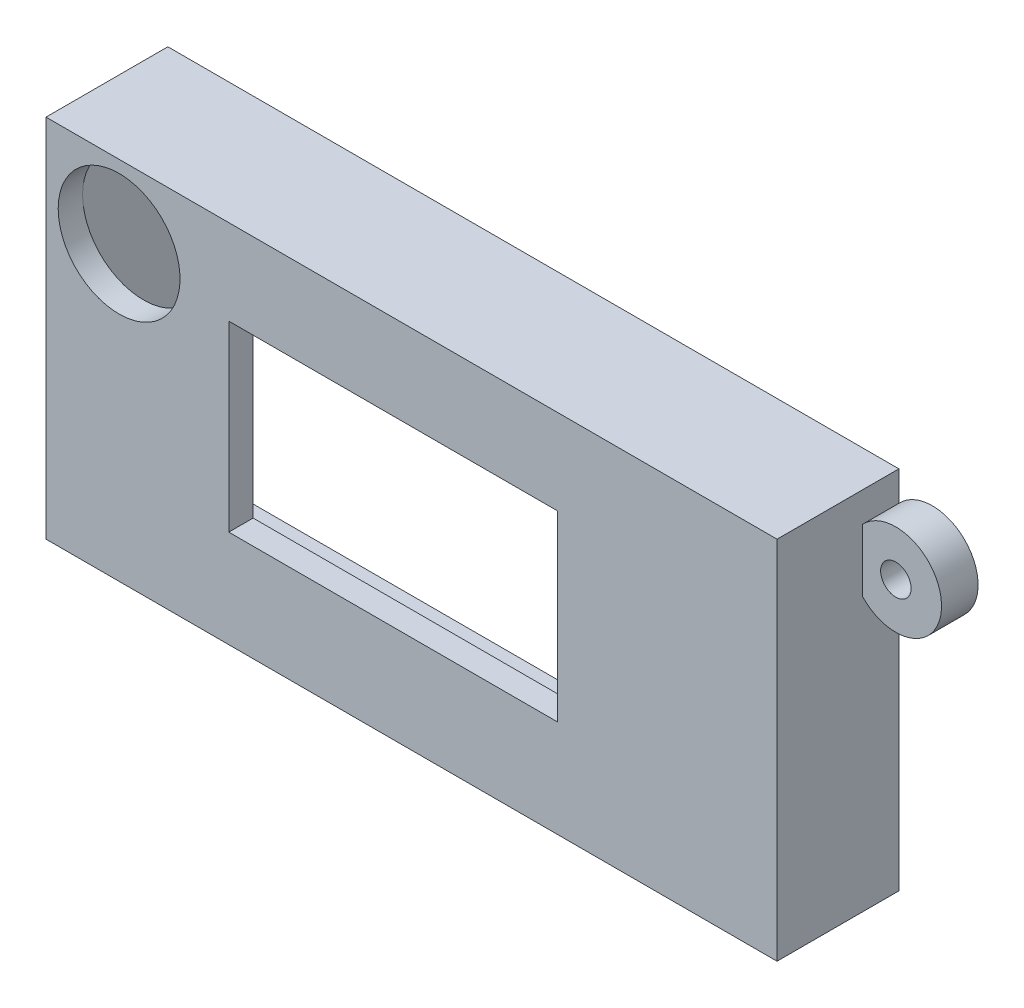
from build123d import *

# Parameters (mm, degrees)
SKIZZE1_W                       = 60
SKIZZE1_H                       = 30
AUFSATZ_LINEAR_AUSTRAGEN1_DEPTH = 10
SKIZZE2_R                       = 5
SKIZZE2_W                       = 27
SKIZZE2_H                       = 15
SCHNITT_LINEAR_AUSTRAGEN2_DEPTH = 36
SKIZZE3_R                       = 1.25
SKIZZE3_W                       = 58
SKIZZE3_H                       = 28
SCHNITT_LINEAR_AUSTRAGEN3_DEPTH = 8
SKIZZE3_4_R                     = 1.25
SKIZZE3_4_W                     = 58
SKIZZE3_4_H                     = 28
AUFSATZ_LINEAR_AUSTRAGEN3_DEPTH = 3
SKIZZE3_5_R                     = 1.25
SKIZZE3_5_W                     = 58
SKIZZE3_5_H                     = 28
SCHNITT_LINEAR_AUSTRAGEN7_DEPTH = 3
SKIZZE3_7_R                     = 1.25
AUFSATZ_LINEAR_AUSTRAGEN4_DEPTH = 3
AUFSATZ_LINEAR_AUSTRAGEN5_DEPTH = 3
SKIZZE3_11_R                    = 1.25
SCHNITT_LINEAR_AUSTRAGEN9_DEPTH = 41.874769712


with BuildPart() as part:
    # Skizze1 → Aufsatz-Linear austragen1 (new body)
    with BuildSketch(Plane.XY):
        Rectangle(SKIZZE1_W, SKIZZE1_H)
    extrude(amount=AUFSATZ_LINEAR_AUSTRAGEN1_DEPTH)

    # Skizze2 → Schnitt-Linear austragen2 (cut, through all)
    with BuildSketch(Plane(origin=(0, 0, 0), x_dir=(-1, 0, 0), z_dir=(0, 0, -1))):
        with Locations((24, 9)):
            Circle(SKIZZE2_R)
        with Locations((1.5, 0.5)):
            Rectangle(SKIZZE2_W, SKIZZE2_H)
    extrude(amount=-SCHNITT_LINEAR_AUSTRAGEN2_DEPTH, mode=Mode.SUBTRACT)

    # Skizze3 → Schnitt-Linear austragen3 (cut)
    # profile 1 of 3: a face of its own
    with BuildSketch(Plane(origin=(0, 0, 0), x_dir=(-1, 0, 0), z_dir=(0, 0, -1))):
        with BuildLine():
            Line((-30, 12.549509757), (-30, 7.450490243))
            ThreePointArc((-30, 7.450490243), (-36.5, 10), (-30, 12.549509757))
        make_face()
        with Locations((-32.75, 10)):
            Circle(SKIZZE3_R, mode=Mode.SUBTRACT)
    # profile 2 of 3: a face of its own
    with BuildSketch(Plane(origin=(0, 0, 0), x_dir=(-1, 0, 0), z_dir=(0, 0, -1))):
        Rectangle(SKIZZE3_W, SKIZZE3_H)
    # profile 3 of 3: a face of its own
    with BuildSketch(Plane(origin=(0, 0, 0), x_dir=(-1, 0, 0), z_dir=(0, 0, -1))):
        with BuildLine():
            Line((30, -8.053874444), (30, -11.946125556))
            ThreePointArc((30, -11.946125556), (36.684421749, -10), (30, -8.053874444))
        make_face()
        with Locations((33.058910028, -10)):
            Circle(SKIZZE3_R, mode=Mode.SUBTRACT)
    extrude(amount=-SCHNITT_LINEAR_AUSTRAGEN3_DEPTH, mode=Mode.SUBTRACT)

    # Skizze3<4> → Aufsatz-Linear austragen3 (add)
    # profile 1 of 3: a face of its own
    with BuildSketch(Plane(origin=(0, 0, 0), x_dir=(-1, 0, 0), z_dir=(0, 0, -1))):
        with BuildLine():
            Line((-30, 12.549509757), (-30, 7.450490243))
            ThreePointArc((-30, 7.450490243), (-36.5, 10), (-30, 12.549509757))
        make_face()
        with Locations((-32.75, 10)):
            Circle(SKIZZE3_4_R, mode=Mode.SUBTRACT)
    # profile 2 of 3: a face of its own
    with BuildSketch(Plane(origin=(0, 0, 0), x_dir=(-1, 0, 0), z_dir=(0, 0, -1))):
        Rectangle(SKIZZE3_4_W, SKIZZE3_4_H)
    # profile 3 of 3: a face of its own
    with BuildSketch(Plane(origin=(0, 0, 0), x_dir=(-1, 0, 0), z_dir=(0, 0, -1))):
        with BuildLine():
            Line((30, -8.053874444), (30, -11.946125556))
            ThreePointArc((30, -11.946125556), (36.684421749, -10), (30, -8.053874444))
        make_face()
        with Locations((33.058910028, -10)):
            Circle(SKIZZE3_4_R, mode=Mode.SUBTRACT)
    extrude(amount=-AUFSATZ_LINEAR_AUSTRAGEN3_DEPTH)

    # Skizze3<5> → Schnitt-Linear austragen7 (cut)
    # profile 1 of 3: a face of its own
    with BuildSketch(Plane(origin=(0, 0, 0), x_dir=(-1, 0, 0), z_dir=(0, 0, -1))):
        with BuildLine():
            Line((-30, 12.549509757), (-30, 7.450490243))
            ThreePointArc((-30, 7.450490243), (-36.5, 10), (-30, 12.549509757))
        make_face()
        with Locations((-32.75, 10)):
            Circle(SKIZZE3_5_R, mode=Mode.SUBTRACT)
    # profile 2 of 3: a face of its own
    with BuildSketch(Plane(origin=(0, 0, 0), x_dir=(-1, 0, 0), z_dir=(0, 0, -1))):
        Rectangle(SKIZZE3_5_W, SKIZZE3_5_H)
    # profile 3 of 3: a face of its own
    with BuildSketch(Plane(origin=(0, 0, 0), x_dir=(-1, 0, 0), z_dir=(0, 0, -1))):
        with BuildLine():
            Line((30, -8.053874444), (30, -11.946125556))
            ThreePointArc((30, -11.946125556), (36.684421749, -10), (30, -8.053874444))
        make_face()
        with Locations((33.058910028, -10)):
            Circle(SKIZZE3_5_R, mode=Mode.SUBTRACT)
    extrude(amount=-SCHNITT_LINEAR_AUSTRAGEN7_DEPTH, mode=Mode.SUBTRACT)

    # Skizze3<7> → Aufsatz-Linear austragen4 (add)
    with BuildSketch(Plane(origin=(0, 0, 0), x_dir=(-1, 0, 0), z_dir=(0, 0, -1))):
        with BuildLine():
            Line((-30, 7.450490243), (-30, 12.549509757))
            ThreePointArc((-30, 12.549509757), (-36.5, 10), (-30, 7.450490243))
        make_face()
        with Locations((-32.75, 10)):
            Circle(SKIZZE3_7_R, mode=Mode.SUBTRACT)
    extrude(amount=-AUFSATZ_LINEAR_AUSTRAGEN4_DEPTH)


with BuildPart() as body_2:
    # Skizze3<9> → Aufsatz-Linear austragen5 (new body)
    with BuildSketch(Plane(origin=(0, 0, 0), x_dir=(-1, 0, 0), z_dir=(0, 0, -1))):
        with BuildLine():
            Line((30, -8.053874444), (30, -11.946125556))
            ThreePointArc((30, -11.946125556), (36.684421749, -10), (30, -8.053874444))
        make_face()
    extrude(amount=-AUFSATZ_LINEAR_AUSTRAGEN5_DEPTH)

    # Skizze3<11> → Schnitt-Linear austragen9 (cut, through all)
    with BuildSketch(Plane(origin=(0, 0, 0), x_dir=(-1, 0, 0), z_dir=(0, 0, -1))):
        with Locations((33.058910028, -10)):
            Circle(SKIZZE3_11_R)
    extrude(amount=-SCHNITT_LINEAR_AUSTRAGEN9_DEPTH, mode=Mode.SUBTRACT)


solid = Compound([part.part, body_2.part])
